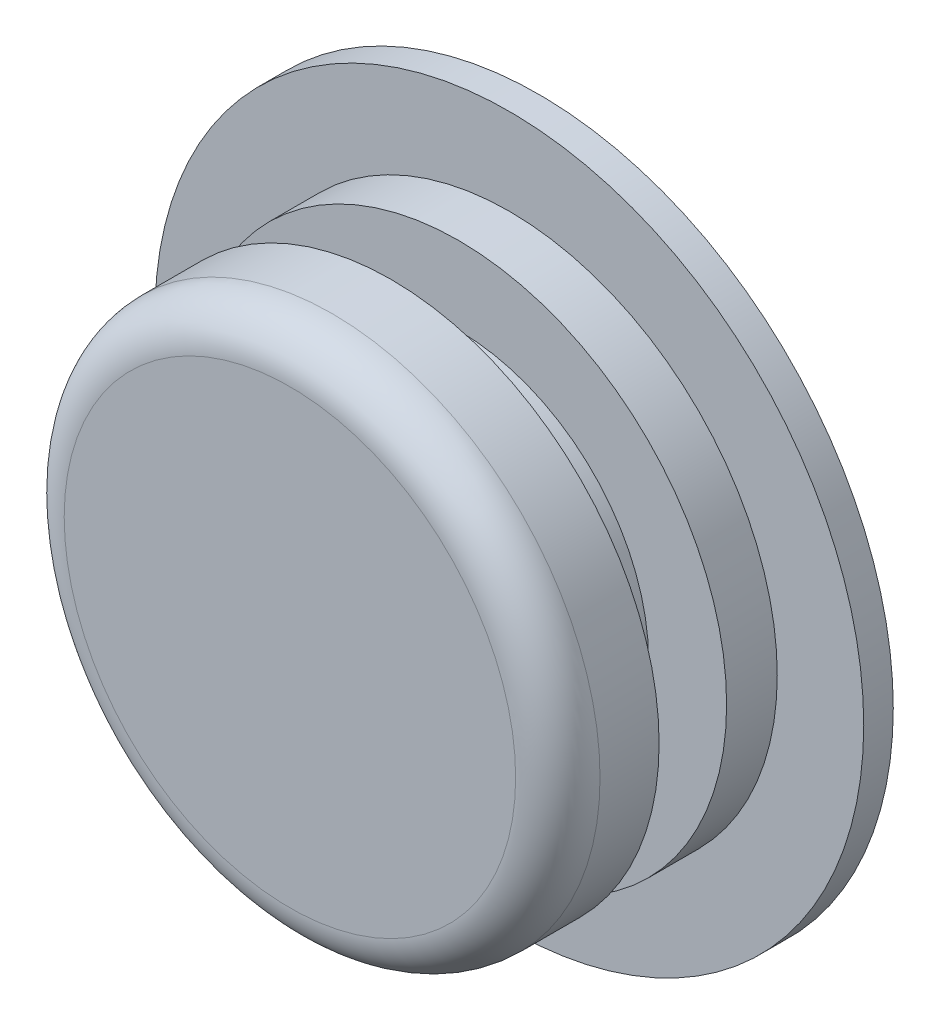
from build123d import *

# Parameters (mm, degrees)
CROQUIS1_R              = 42
SALIENTE_EXTRUIR1_DEPTH = 3.5
CROQUIS2_R              = 31.75
SALIENTE_EXTRUIR2_DEPTH = 6
CROQUIS3_R              = 22.5
SALIENTE_EXTRUIR3_DEPTH = 8
CROQUIS4_R              = 31.75
SALIENTE_EXTRUIR4_DEPTH = 12
REDONDEO1_R             = 5


with BuildPart() as part:
    # Croquis1 → Saliente-Extruir1 (new body)
    with BuildSketch(Plane.XY):
        Circle(CROQUIS1_R)
    extrude(amount=SALIENTE_EXTRUIR1_DEPTH)

    # Croquis2 → Saliente-Extruir2 (add)
    with BuildSketch(Plane.XY.offset(3.5)):
        Circle(CROQUIS2_R)
    extrude(amount=SALIENTE_EXTRUIR2_DEPTH)

    # Croquis3 → Saliente-Extruir3 (add)
    with BuildSketch(Plane.XY.offset(9.5)):
        Circle(CROQUIS3_R)
    extrude(amount=SALIENTE_EXTRUIR3_DEPTH)


with BuildPart() as body_2:
    # Croquis4 → Saliente-Extruir4 (new body)
    with BuildSketch(Plane.XY.offset(17.5)):
        Circle(CROQUIS4_R)
    extrude(amount=SALIENTE_EXTRUIR4_DEPTH)

    # Redondeo1
    redondeo1_edges = [body_2.edges().sort_by_distance(p)[0] for p in [
        (-31.75, 0, 29.5),
    ]]
    fillet(redondeo1_edges, radius=REDONDEO1_R)


solid = Compound([part.part, body_2.part])
